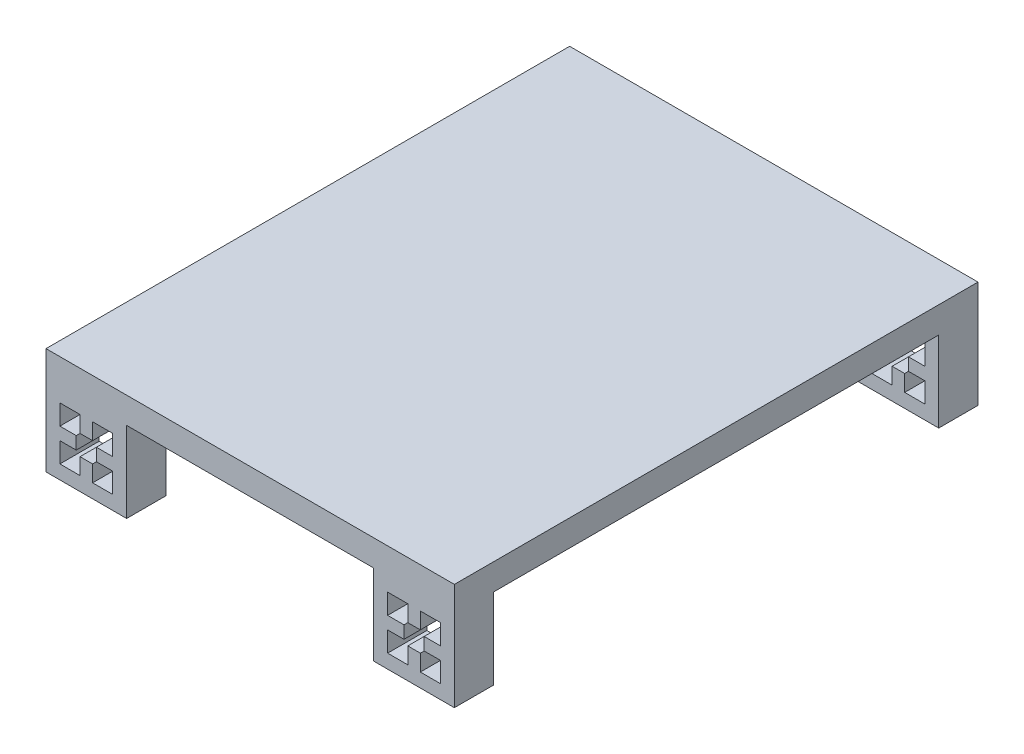
from build123d import *

# Parameters (mm, degrees)
ESQUISSE1_W         = 30.8
ESQUISSE1_H         = 30.8
BOSS_EXTRU_1_DEPTH  = 15
ESQUISSE6_W         = 155.98
ESQUISSE6_H         = 200
BOSS_EXTRU_4_DEPTH  = 10
ESQUISSE16_W        = 30.8
ESQUISSE16_H        = 30.8
BOSS_EXTRU_12_DEPTH = 15
ESQUISSE25_W        = 30.8
ESQUISSE25_H        = 30.8
BOSS_EXTRU_21_DEPTH = 15
ESQUISSE26_W        = 30.8
ESQUISSE26_H        = 30.8
BOSS_EXTRU_22_DEPTH = 15


with BuildPart() as part:
    # Esquisse1 → Boss.-Extru.1 (new body)
    with BuildSketch(Plane.XY):
        with Locations((-26.267627057, 8.434243976)):
            Rectangle(ESQUISSE1_W, ESQUISSE1_H)
        Polygon((-30.117627057, 6.034243976), (-30.117627057, 10.834243976), (-36.367627057, 10.834243976), (-36.367627057, 18.534243976), (-28.667627057, 18.534243976), (-28.667627057, 12.284243976), (-23.867627057, 12.284243976), (-23.867627057, 18.534243976), (-16.177627057, 18.534243976), (-16.177627057, 10.834243976), (-22.427627057, 10.834243976), (-22.427627057, 6.034243976), (-16.177627057, 6.034243976), (-16.177627057, -1.665756024), (-23.867627057, -1.665756024), (-23.867627057, 4.584243976), (-28.667627057, 4.584243976), (-28.667627057, -1.665756024), (-36.367627057, -1.665756024), (-36.367627057, 6.034243976), align=None, mode=Mode.SUBTRACT)
    extrude(amount=BOSS_EXTRU_1_DEPTH)

    # Esquisse6 → Boss.-Extru.4 (add)
    with BuildSketch(Plane(origin=(0, 23.834243976, 0), x_dir=(1, 0, 0), z_dir=(0, 1, 0))):
        with Locations((36.322372943, 85)):
            Rectangle(ESQUISSE6_W, ESQUISSE6_H)
    extrude(amount=BOSS_EXTRU_4_DEPTH)

    # Esquisse16 → Boss.-Extru.12 (add)
    with BuildSketch(Plane.XY.offset(15)):
        with Locations((98.912372943, 8.434243976)):
            Rectangle(ESQUISSE16_W, ESQUISSE16_H)
        Polygon((95.062372943, 6.034243976), (95.062372943, 10.834243976), (88.812372943, 10.834243976), (88.812372943, 18.534243976), (96.512372943, 18.534243976), (96.512372943, 12.284243976), (101.312372943, 12.284243976), (101.312372943, 18.534243976), (109.002372943, 18.534243976), (109.002372943, 10.834243976), (102.752372943, 10.834243976), (102.752372943, 6.034243976), (109.002372943, 6.034243976), (109.002372943, -1.665756024), (101.312372943, -1.665756024), (101.312372943, 4.584243976), (96.512372943, 4.584243976), (96.512372943, -1.665756024), (88.812372943, -1.665756024), (88.812372943, 6.034243976), align=None, mode=Mode.SUBTRACT)
    extrude(amount=-BOSS_EXTRU_12_DEPTH)

    # Esquisse25 → Boss.-Extru.21 (add)
    with BuildSketch(Plane(origin=(0, 0, -185), x_dir=(-1, 0, 0), z_dir=(0, 0, -1))):
        with Locations((-98.912372943, 8.434243976)):
            Rectangle(ESQUISSE25_W, ESQUISSE25_H)
        Polygon((-102.762372943, 6.034243976), (-102.762372943, 10.834243976), (-109.012372943, 10.834243976), (-109.012372943, 18.534243976), (-101.312372943, 18.534243976), (-101.312372943, 12.284243976), (-96.512372943, 12.284243976), (-96.512372943, 18.534243976), (-88.822372943, 18.534243976), (-88.822372943, 10.834243976), (-95.072372943, 10.834243976), (-95.072372943, 6.034243976), (-88.822372943, 6.034243976), (-88.822372943, -1.665756024), (-96.512372943, -1.665756024), (-96.512372943, 4.584243976), (-101.312372943, 4.584243976), (-101.312372943, -1.665756024), (-109.012372943, -1.665756024), (-109.012372943, 6.034243976), align=None, mode=Mode.SUBTRACT)
    extrude(amount=-BOSS_EXTRU_21_DEPTH)

    # Esquisse26 → Boss.-Extru.22 (add)
    with BuildSketch(Plane(origin=(0, 0, -185), x_dir=(-1, 0, 0), z_dir=(0, 0, -1))):
        with Locations((26.267627057, 8.434243976)):
            Rectangle(ESQUISSE26_W, ESQUISSE26_H)
        Polygon((22.417627057, 6.034243976), (22.417627057, 10.834243976), (16.167627057, 10.834243976), (16.167627057, 18.534243976), (23.867627057, 18.534243976), (23.867627057, 12.284243976), (28.667627057, 12.284243976), (28.667627057, 18.534243976), (36.357627057, 18.534243976), (36.357627057, 10.834243976), (30.107627057, 10.834243976), (30.107627057, 6.034243976), (36.357627057, 6.034243976), (36.357627057, -1.665756024), (28.667627057, -1.665756024), (28.667627057, 4.584243976), (23.867627057, 4.584243976), (23.867627057, -1.665756024), (16.167627057, -1.665756024), (16.167627057, 6.034243976), align=None, mode=Mode.SUBTRACT)
    extrude(amount=-BOSS_EXTRU_22_DEPTH)


solid = part.part
